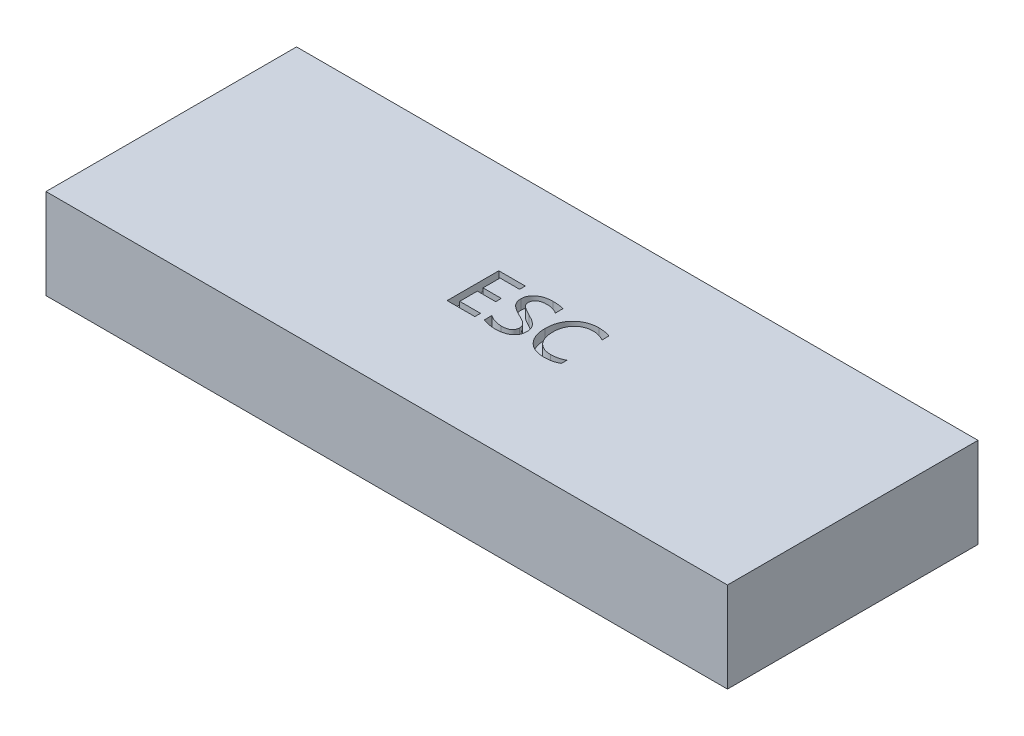
from build123d import *

# Parameters (mm, degrees)
SKETCH_1_W          = 68
SKETCH_1_H          = 25
EXTRUDE_1_DEPTH     = 9
CUT_EXTRUDE_1_DEPTH = 1


with BuildPart() as part:
    # 草图1 → 凸台-拉伸1 (new body)
    with BuildSketch(Plane(origin=(0, 0, 0), x_dir=(1, 0, 0), z_dir=(0, 1, 0))):
        Rectangle(SKETCH_1_W, SKETCH_1_H)
    extrude(amount=EXTRUDE_1_DEPTH)

    # 草图2 → 切除-拉伸1 (cut)
    with BuildSketch(Plane(origin=(0, 9, 0), x_dir=(1, 0, 0), z_dir=(0, 1, 0))):
        Polygon((-1.794874634, -1.912278414), (-4.561656027, -1.912278414), (-4.561656027, 3.243996001), (-1.920637424, 3.243996001), (-1.920637424, 2.678063443), (-3.869960678, 2.678063443), (-3.869960678, 0.98026577), (-2.046400215, 0.98026577), (-2.046400215, 0.414333212), (-3.869960678, 0.414333212), (-3.869960678, -1.346345856), (-1.794874634, -1.346345856), align=None)
        with BuildLine():
            add(Edge.make_bspline(
                [(-1.04029789, -0.953337135), (-0.998403857, -0.986085055), (-0.911814494, -1.053770625), (-0.763181141, -1.139727162), (-0.59560172, -1.217035625), (-0.412060324, -1.283998063), (-0.221698802, -1.339287732), (-0.031738407, -1.378314308), (0.15272369, -1.404734677), (0.274558186, -1.407749943), (0.33425011, -1.409227251)],
                knots=[0, 0, 0, 0, 0.865539583, 1.788954577, 2.789281186, 3.869785964, 4.969270071, 6.015824901, 7.027867855, 8, 8, 8, 8], degree=3))
            add(Edge.make_bspline(
                [(0.33425011, -1.409227251), (0.377820398, -1.408670004), (0.462109109, -1.407591984), (0.58455588, -1.399076247), (0.698274856, -1.383032685), (0.803779808, -1.362906532), (0.900941389, -1.336617333), (0.989604283, -1.303021331), (1.070480395, -1.264039988), (1.142848862, -1.218777866), (1.206343619, -1.167114557), (1.261892522, -1.110063094), (1.308515454, -1.046587755), (1.346256432, -0.976734664), (1.375324843, -0.900988573), (1.39738794, -0.819445364), (1.41015894, -0.731693425), (1.411425602, -0.671067619), (1.412076526, -0.639912681)],
                knots=[0, 0, 0, 0, 1.387952524, 2.685057481, 3.906752822, 5.044389127, 6.104925896, 7.10867273, 8.060544729, 8.960756871, 9.821090645, 10.662232403, 11.49066096, 12.321647717, 13.183814073, 14.069581906, 15.007979264, 16, 16, 16, 16], degree=3))
            add(Edge.make_bspline(
                [(1.412076526, -0.639912681), (1.4109002, -0.604747071), (1.408589897, -0.535681886), (1.385923867, -0.434983307), (1.349691433, -0.339655027), (1.297283764, -0.251018516), (1.233768834, -0.166854545), (1.159107692, -0.08771528), (1.073680683, -0.013176744), (0.99276462, 0.043946195), (0.91853179, 0.090314542), (0.851767531, 0.130951837), (0.773366495, 0.174413764), (0.684341819, 0.222996366), (0.584060994, 0.275950397), (0.472679311, 0.333542295), (0.350190603, 0.395775412), (0.264848863, 0.438301638), (0.220277581, 0.460511737)],
                knots=[0, 0, 0, 0, 0.982941607, 1.930495303, 2.873604538, 3.826420128, 4.801766699, 5.819939166, 6.86595615, 7.96993426, 8.587927195, 9.315806065, 10.157204154, 11.096563792, 12.154522406, 13.331194997, 14.606167838, 16, 16, 16, 16], degree=3))
            add(Edge.make_bspline(
                [(0.220277581, 0.460511737), (0.158499012, 0.491885075), (0.03959451, 0.552268979), (-0.128526774, 0.645660161), (-0.280096391, 0.736839393), (-0.41554373, 0.826167801), (-0.534402263, 0.914643557), (-0.638125119, 1.000188447), (-0.724263105, 1.085287045), (-0.795935546, 1.168742841), (-0.853232914, 1.254545685), (-0.904179353, 1.341012117), (-0.945980806, 1.431380545), (-0.980775536, 1.524249166), (-1.007431953, 1.619919918), (-1.025671042, 1.718592026), (-1.038176476, 1.820004059), (-1.039585427, 1.888732696), (-1.04029789, 1.923486699)],
                knots=[0, 0, 0, 0, 1.619222821, 3.116499544, 4.493497657, 5.752362701, 6.906613858, 7.955228956, 8.891569654, 9.733419001, 10.521050387, 11.299554277, 12.076853168, 12.844596608, 13.615272338, 14.394378029, 15.188085306, 16, 16, 16, 16], degree=3))
            add(Edge.make_bspline(
                [(-1.04029789, 1.923486699), (-1.038969964, 1.975343205), (-1.036373872, 2.076722498), (-1.010695549, 2.224367758), (-0.970825122, 2.364184522), (-0.913378127, 2.495522489), (-0.839844154, 2.618456949), (-0.750574433, 2.733370269), (-0.644778782, 2.840042619), (-0.522796398, 2.936101108), (-0.389740623, 3.023488779), (-0.246540203, 3.098707098), (-0.095926342, 3.164578392), (0.064067137, 3.215644252), (0.231557281, 3.25788829), (0.408218404, 3.285218571), (0.592912746, 3.303753525), (0.719022888, 3.305823145), (0.783262573, 3.306877396)],
                knots=[0, 0, 0, 0, 0.970444009, 1.897214754, 2.797959901, 3.688009903, 4.573800912, 5.474420727, 6.406999593, 7.380328003, 8.377337185, 9.384428898, 10.406559165, 11.452128656, 12.526295673, 13.638633029, 14.797135032, 16, 16, 16, 16], degree=3))
            add(Edge.make_bspline(
                [(0.783262573, 3.306877396), (0.845498091, 3.306638809), (0.965425734, 3.306179053), (1.139042697, 3.298791436), (1.300011946, 3.288731822), (1.448089775, 3.272795673), (1.583351052, 3.253885916), (1.705480215, 3.228791803), (1.815695105, 3.201868432), (1.883210489, 3.177102225), (1.915127689, 3.165394256)],
                knots=[0, 0, 0, 0, 1.302853371, 2.510594277, 3.637626783, 4.678791113, 5.628121996, 6.495466126, 7.288747155, 8, 8, 8, 8], degree=3))
            Line((1.915127689, 3.165394256), (1.915127689, 2.410817513))
            add(Edge.make_bspline(
                [(1.915127689, 2.410817513), (1.875357643, 2.43755238), (1.795191592, 2.491442907), (1.664594201, 2.557004262), (1.527706619, 2.614892001), (1.382456083, 2.660541153), (1.2298844, 2.697306768), (1.069484684, 2.722034559), (0.901514439, 2.738617836), (0.786907476, 2.740156971), (0.728241352, 2.740944838)],
                knots=[0, 0, 0, 0, 0.918063685, 1.850577229, 2.796465716, 3.76568756, 4.766461771, 5.803068333, 6.875413303, 8, 8, 8, 8], degree=3))
            add(Edge.make_bspline(
                [(0.728241352, 2.740944838), (0.689566626, 2.740528753), (0.613723202, 2.739712787), (0.502644299, 2.728899013), (0.396753217, 2.715244014), (0.296564139, 2.693357177), (0.202113415, 2.664686492), (0.112610152, 2.630577164), (0.028807483, 2.590142195), (-0.048910777, 2.544422749), (-0.118751143, 2.492370902), (-0.180229506, 2.435169819), (-0.23245441, 2.373224474), (-0.275877571, 2.306547203), (-0.307751995, 2.234288773), (-0.332094688, 2.157666056), (-0.345578013, 2.075923354), (-0.347582776, 2.019819257), (-0.348602542, 1.991280704)],
                knots=[0, 0, 0, 0, 1.262873919, 2.476570353, 3.643139105, 4.749062229, 5.821993494, 6.865119038, 7.874788035, 8.858269162, 9.806190946, 10.714523887, 11.595346505, 12.447099743, 13.304211657, 14.16711336, 15.067662888, 16, 16, 16, 16], degree=3))
            add(Edge.make_bspline(
                [(-0.348602542, 1.991280704), (-0.348169931, 1.965695012), (-0.347323471, 1.915633178), (-0.336748084, 1.842395856), (-0.321787465, 1.772706942), (-0.298698801, 1.706860861), (-0.268872743, 1.644921678), (-0.233960328, 1.585910813), (-0.191782245, 1.531146127), (-0.142332362, 1.478536723), (-0.081015219, 1.426574863), (-0.006993701, 1.370848281), (0.081241111, 1.309551528), (0.186433621, 1.246764315), (0.304664446, 1.176494959), (0.438855038, 1.103412041), (0.587103377, 1.024247383), (0.692070918, 0.972125236), (0.746909267, 0.944894985)],
                knots=[0, 0, 0, 0, 0.763187322, 1.493278232, 2.204869393, 2.8882267, 3.570463978, 4.254590241, 4.931199563, 5.629775194, 6.406064603, 7.327097772, 8.395636964, 9.611359167, 10.983030847, 12.501525311, 14.172286663, 16, 16, 16, 16], degree=3))
            add(Edge.make_bspline(
                [(0.746909267, 0.944894985), (0.807778422, 0.915639379), (0.925716391, 0.858954729), (1.092390555, 0.767687706), (1.246626073, 0.678995065), (1.38552444, 0.588492518), (1.511501036, 0.499649004), (1.621272366, 0.408740915), (1.718869313, 0.319593283), (1.801820401, 0.228406479), (1.873693672, 0.136220782), (1.93435732, 0.041429986), (1.987587976, -0.055205621), (2.029177377, -0.155676984), (2.063320452, -0.25827079), (2.086784534, -0.36393609), (2.1007618, -0.47250669), (2.102761899, -0.545877101), (2.103771874, -0.582926416)],
                knots=[0, 0, 0, 0, 1.495451289, 2.897534645, 4.207528201, 5.434805374, 6.568069241, 7.619400329, 8.589444755, 9.493079686, 10.346190292, 11.175121977, 11.98325998, 12.786172757, 13.579825473, 14.375232997, 15.179553389, 16, 16, 16, 16], degree=3))
            add(Edge.make_bspline(
                [(2.103771874, -0.582926416), (2.102228044, -0.637365506), (2.09921021, -0.743781406), (2.076712468, -0.898474699), (2.038083446, -1.043066532), (1.985094969, -1.178542434), (1.914832889, -1.303209192), (1.83024366, -1.41880039), (1.730686987, -1.52465585), (1.614619412, -1.618271757), (1.486843451, -1.703554702), (1.345519179, -1.775412245), (1.193365627, -1.838311274), (1.028719687, -1.887014185), (0.853167725, -1.928536324), (0.665006682, -1.954625565), (0.465248858, -1.971860592), (0.328067034, -1.974040338), (0.257613409, -1.975159809)],
                knots=[0, 0, 0, 0, 0.998720149, 1.952268215, 2.860405487, 3.739753107, 4.61411738, 5.478324305, 6.362545509, 7.272033822, 8.208731329, 9.176321298, 10.176215934, 11.225542546, 12.323227065, 13.483292636, 14.707473419, 16, 16, 16, 16], degree=3))
            add(Edge.make_bspline(
                [(0.257613409, -1.975159809), (0.204852603, -1.974148527), (0.094886894, -1.972040781), (-0.075855251, -1.956035105), (-0.259458039, -1.93257661), (-0.448821524, -1.899854877), (-0.631901913, -1.862733363), (-0.792754952, -1.815660094), (-0.928862162, -1.769601696), (-1.005376778, -1.727245266), (-1.04029789, -1.707913879)],
                knots=[0, 0, 0, 0, 0.94778004, 1.975392569, 3.078888875, 4.272571661, 5.427769523, 6.431590237, 7.284181021, 8, 8, 8, 8], degree=3))
            Line((-1.04029789, -1.707913879), (-1.04029789, -0.953337135))
        make_face()
        with BuildLine():
            add(Edge.make_bspline(
                [(6.56835094, -1.645032484), (6.519967602, -1.671738116), (6.422499199, -1.725536706), (6.266626754, -1.791919048), (6.102611167, -1.849176941), (5.929016874, -1.894834976), (5.74699788, -1.931529168), (5.555589707, -1.95638346), (5.355550654, -1.972744231), (5.219054755, -1.974345098), (5.149589459, -1.975159809)],
                knots=[0, 0, 0, 0, 0.899587119, 1.812221402, 2.755215595, 3.72691978, 4.733275595, 5.777347896, 6.8688511, 8, 8, 8, 8], degree=3))
            add(Edge.make_bspline(
                [(5.149589459, -1.975159809), (5.060081374, -1.973163521), (4.88503826, -1.969259555), (4.629325918, -1.936421552), (4.38741272, -1.881597387), (4.159382691, -1.804567421), (3.944438075, -1.707232028), (3.743692306, -1.58691588), (3.558473831, -1.442671447), (3.386331723, -1.280313303), (3.232734808, -1.098657203), (3.098289694, -0.902168679), (2.984549765, -0.691458878), (2.892257498, -0.466412123), (2.820334517, -0.227485239), (2.770037448, 0.02553684), (2.737351116, 0.29229913), (2.734197413, 0.475149885), (2.732585827, 0.568589135)],
                knots=[0, 0, 0, 0, 1.085331975, 2.122488584, 3.120814145, 4.089326929, 5.036797346, 5.977607565, 6.920729525, 7.878890069, 8.842740095, 9.800208707, 10.761764006, 11.741413909, 12.745507817, 13.783196789, 14.867183078, 16, 16, 16, 16], degree=3))
            add(Edge.make_bspline(
                [(2.732585827, 0.568589135), (2.734831506, 0.668907089), (2.73922652, 0.865239207), (2.774160875, 1.152324883), (2.831482448, 1.424545211), (2.913517146, 1.681486968), (3.017981669, 1.923497427), (3.144964799, 2.150898605), (3.296529882, 2.362518861), (3.470263198, 2.556919822), (3.660416053, 2.733127799), (3.865590178, 2.886890082), (4.083310668, 3.016832059), (4.313269349, 3.123810606), (4.556311588, 3.205471879), (4.811300257, 3.264118837), (5.079113531, 3.300459889), (5.261808131, 3.3047106), (5.354936515, 3.306877396)],
                knots=[0, 0, 0, 0, 1.130299497, 2.212107448, 3.253825987, 4.261185501, 5.246476185, 6.219803443, 7.19077645, 8.173776183, 9.153270337, 10.10775086, 11.057875369, 12.005760472, 12.960526409, 13.941799213, 14.95083426, 16, 16, 16, 16], degree=3))
            add(Edge.make_bspline(
                [(5.354936515, 3.306877396), (5.414887799, 3.306447649), (5.531928334, 3.305608671), (5.703628379, 3.295087813), (5.867326051, 3.280218619), (6.023258242, 3.257032804), (6.171416927, 3.229432507), (6.311247081, 3.193454198), (6.443627704, 3.153140772), (6.527306359, 3.119173762), (6.56835094, 3.102512861)],
                knots=[0, 0, 0, 0, 1.161494932, 2.267540887, 3.332194927, 4.345448988, 5.321224661, 6.250881651, 7.142053245, 8, 8, 8, 8], degree=3))
            Line((6.56835094, 3.102512861), (6.56835094, 2.410817513))
            add(Edge.make_bspline(
                [(6.56835094, 2.410817513), (6.522561235, 2.437424781), (6.431398283, 2.490397323), (6.288015535, 2.556623426), (6.141869996, 2.614065035), (5.991938573, 2.659919788), (5.839164891, 2.696947852), (5.682747836, 2.721783619), (5.522983761, 2.738493215), (5.415241323, 2.740122203), (5.360831646, 2.740944838)],
                knots=[0, 0, 0, 0, 1.002237574, 1.995359766, 2.986854396, 3.97345023, 4.961623326, 5.960690561, 6.97015356, 8, 8, 8, 8], degree=3))
            add(Edge.make_bspline(
                [(5.360831646, 2.740944838), (5.290967418, 2.739442629), (5.153948497, 2.736496472), (4.953774305, 2.70757065), (4.762850905, 2.664294353), (4.581943887, 2.600956135), (4.411258671, 2.519208404), (4.250943273, 2.418744547), (4.100013134, 2.301718504), (3.960770643, 2.166670329), (3.833882001, 2.017328618), (3.724966891, 1.852705737), (3.630520959, 1.677257415), (3.554888839, 1.487905456), (3.496316144, 1.286102675), (3.454039004, 1.07212443), (3.429544212, 0.845576071), (3.426066868, 0.690481856), (3.424281176, 0.610837573)],
                knots=[0, 0, 0, 0, 1.033663525, 2.027238623, 2.988109025, 3.928090998, 4.858432391, 5.784049184, 6.723843567, 7.680533452, 8.650850156, 9.619068902, 10.59733604, 11.595832165, 12.631483779, 13.704077761, 14.820993533, 16, 16, 16, 16], degree=3))
            add(Edge.make_bspline(
                [(3.424281176, 0.610837573), (3.425713691, 0.535446624), (3.42851136, 0.388209879), (3.45254778, 0.173308335), (3.491484067, -0.029883537), (3.546204213, -0.221186634), (3.617557281, -0.400423921), (3.703749286, -0.568071628), (3.806802678, -0.723372692), (3.924442562, -0.865600062), (4.05505382, -0.993143872), (4.195901364, -1.105155995), (4.347292057, -1.198651248), (4.507814204, -1.276180479), (4.678193078, -1.336121267), (4.858747608, -1.378141862), (5.048614038, -1.404168515), (5.178653092, -1.407520019), (5.244894074, -1.409227251)],
                knots=[0, 0, 0, 0, 1.18038591, 2.305265836, 3.381576293, 4.417230172, 5.416334653, 6.398161867, 7.364065079, 8.32942343, 9.283322953, 10.218126537, 11.141832792, 12.064028395, 13.004890902, 13.964070808, 14.962911952, 16, 16, 16, 16], degree=3))
            add(Edge.make_bspline(
                [(5.244894074, -1.409227251), (5.307158256, -1.408409773), (5.429926976, -1.406797918), (5.610973474, -1.390256719), (5.786339547, -1.365361095), (5.955262968, -1.328716924), (6.118322897, -1.282846692), (6.274594894, -1.225230167), (6.425748802, -1.159420181), (6.520952764, -1.105796816), (6.56835094, -1.079099926)],
                knots=[0, 0, 0, 0, 1.082356838, 2.134125263, 3.158528151, 4.160413235, 5.137405624, 6.101214564, 7.054672035, 8, 8, 8, 8], degree=3))
            Line((6.56835094, -1.079099926), (6.56835094, -1.645032484))
        make_face()
    extrude(amount=-CUT_EXTRUDE_1_DEPTH, mode=Mode.SUBTRACT)


solid = part.part
